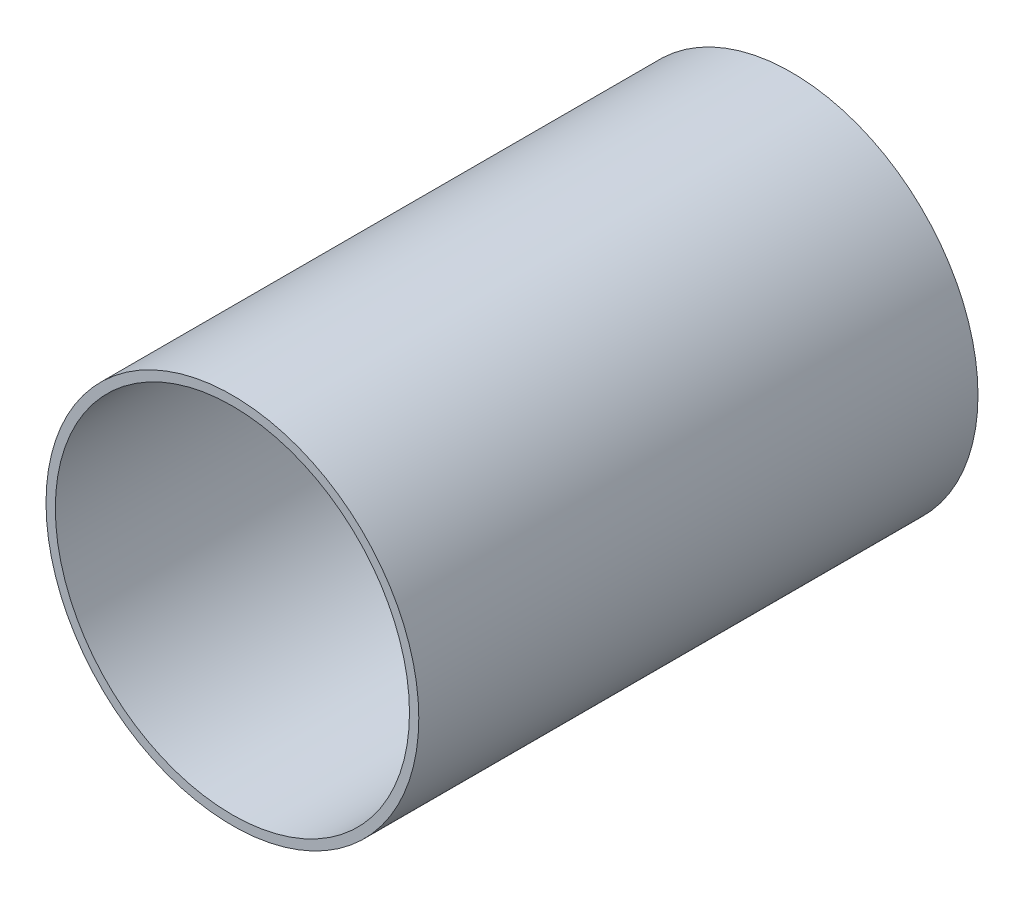
from build123d import *

# Parameters (mm, degrees)
SKETCH_1_R      = 10
SKETCH_1_R_2    = 9.5
EXTRUDE_1_DEPTH = 30


with BuildPart() as part:
    # 草图1 → 凸台-拉伸1 (new body)
    with BuildSketch(Plane.XY):
        Circle(SKETCH_1_R)
        Circle(SKETCH_1_R_2, mode=Mode.SUBTRACT)
    extrude(amount=EXTRUDE_1_DEPTH)


solid = part.part
